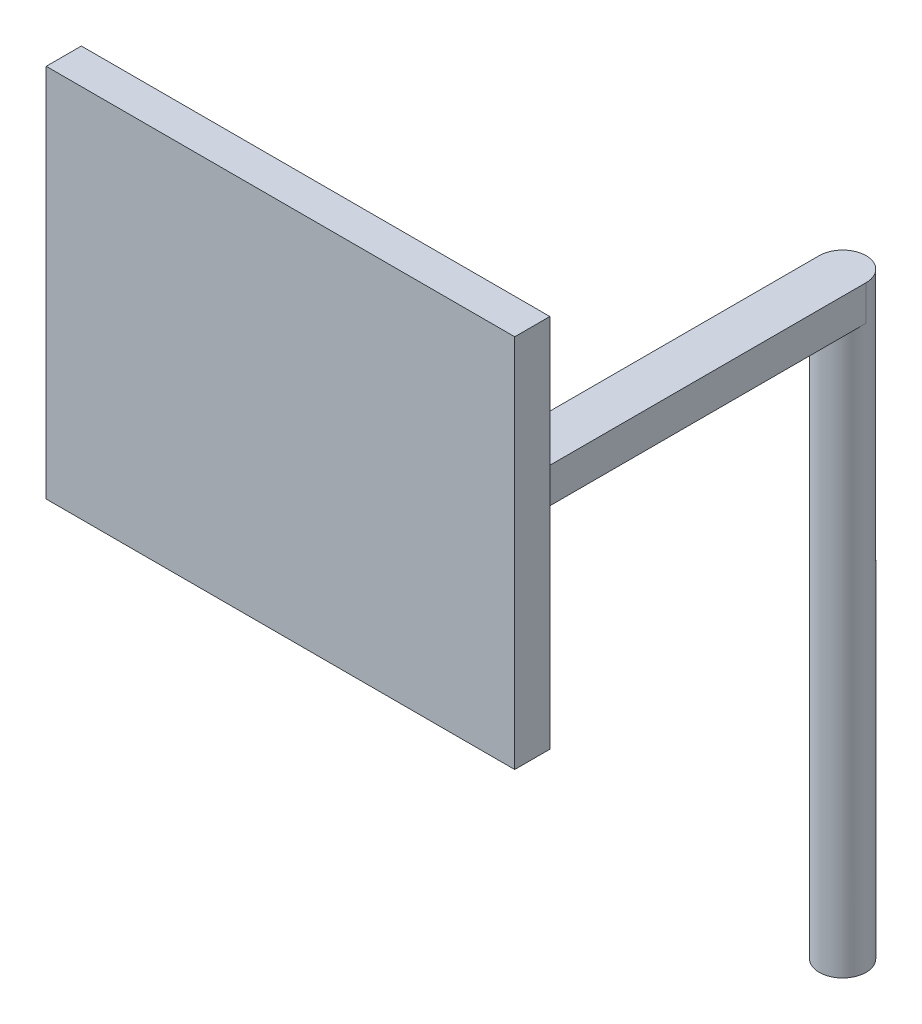
from build123d import *

# Parameters (mm, degrees)
SKETCH1_R           = 5
BRANCH_DEPTH        = 120
BOSS_EXTRUDE1_DEPTH = 7.5
SKETCH3_W           = 100
SKETCH3_H           = 80
BOSS_EXTRUDE2_DEPTH = 7.5


with BuildPart() as part:
    # Sketch1 → branch (new body)
    with BuildSketch(Plane(origin=(0, 0, 0), x_dir=(1, 0, 0), z_dir=(0, 1, 0))):
        with Locations(Location((0, 0, 0), (0, 0, 270))):
            Circle(SKETCH1_R)
    extrude(amount=BRANCH_DEPTH)

    # Sketch2 → Boss-Extrude1 (add)
    with BuildSketch(Plane(origin=(0, 120, 0), x_dir=(1, 0, 0), z_dir=(0, 1, 0))):
        with BuildLine():
            Line((-5, 0), (-5, -120))
            Line((-5, -120), (5, -120))
            Line((5, -120), (5, 0))
            ThreePointArc((5, 0), (0, 5), (-5, 0))
        make_face()
    extrude(amount=BOSS_EXTRUDE1_DEPTH)

    # Sketch3 → Boss-Extrude2 (add)
    with BuildSketch(Plane.XY.offset(120)):
        with Locations((0, 160)):
            Rectangle(SKETCH3_W, SKETCH3_H)
    extrude(amount=-BOSS_EXTRUDE2_DEPTH)


solid = part.part
